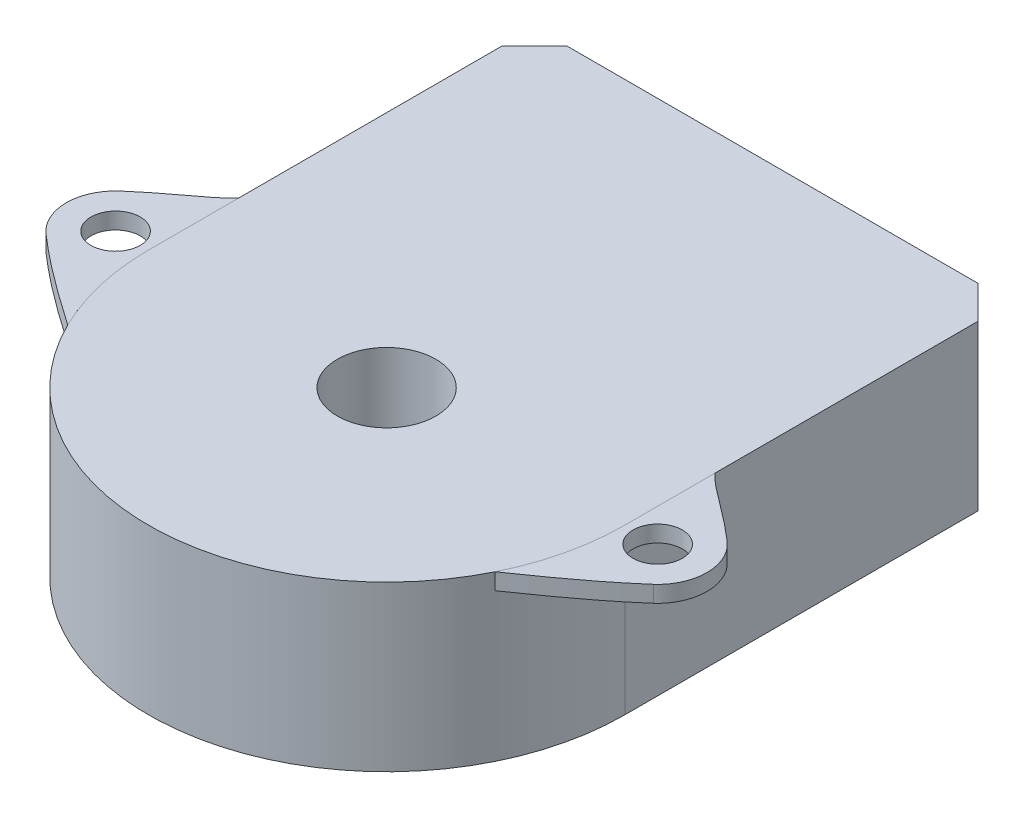
from build123d import *

# Parameters (mm, degrees)
CROQUIS1_R                = 3
SALIENTE_EXTRUIR1_DEPTH   = 10
CROQUIS2_R                = 1.5
SALIENTE_EXTRUIR2_DEPTH   = 1
SALIENTE_EXTRUIR2_2_DEPTH = 1
CHAFL_N1_SIZE             = 2


with BuildPart() as part:
    # Croquis1 → Saliente-Extruir1 (new body)
    with BuildSketch(Plane(origin=(0, 0, 0), x_dir=(-1, 0, 0), z_dir=(0, 1, 0))):
        with BuildLine():
            Line((14.5, 0), (14.5, 23.5))
            ThreePointArc((14.5, 23.5), (0, 38), (-14.5, 23.5))
            Line((-14.5, 23.5), (-14.5, 0))
            Line((-14.5, 0), (14.5, 0))
        make_face()
        with Locations(Location((0, 23.5, 0), (0, 0, 90))):
            Circle(CROQUIS1_R, mode=Mode.SUBTRACT)
    extrude(amount=SALIENTE_EXTRUIR1_DEPTH)

    # Chaflán1
    chafl_n1_edges = [part.edges().sort_by_distance(p)[0] for p in [
        (-14.5, 5, 0),
        (14.5, 5, 0),
    ]]
    chamfer(chafl_n1_edges, length=CHAFL_N1_SIZE)


with BuildPart() as body_2:
    # Croquis2 → Saliente-Extruir2 (new body)
    with BuildSketch(Plane(origin=(0, 10, 0), x_dir=(-1, 0, 0), z_dir=(0, 1, 0))):
        with BuildLine():
            Line((-14.5, 18), (-14.5, 23.5))
            ThreePointArc((-14.5, 23.5), (-14.122863947, 26.785530998), (-13.011073939, 29.900152729))
            add(Edge.make_bspline(
                [(-13.011073939, 29.900152729), (-14.952678114, 28.568382729), (-16.899307295, 27.147844067), (-18.484313483, 25.75)],
                knots=[0, 0, 0, 0, 1, 1, 1, 1], degree=3))
            ThreePointArc((-18.484313483, 25.75), (-19.5, 23.5), (-18.484313483, 21.25))
            add(Edge.make_bspline(
                [(-14.5, 18), (-14.951474475, 18.627261122), (-16.864269141, 19.821255186), (-18.484313483, 21.25)],
                knots=[0.453928844, 0.453928844, 0.453928844, 0.453928844, 1, 1, 1, 1], degree=3))
        make_face()
        with Locations(Location((-16.5, 23.5, 0), (0, 0, 90))):
            Circle(CROQUIS2_R, mode=Mode.SUBTRACT)
    extrude(amount=-SALIENTE_EXTRUIR2_DEPTH)


with BuildPart() as body_3:
    # Croquis2 → Saliente-Extruir2 2 (new body)
    with BuildSketch(Plane(origin=(0, 10, 0), x_dir=(-1, 0, 0), z_dir=(0, 1, 0))):
        with BuildLine():
            add(Edge.make_bspline(
                [(13.011073939, 29.900152729), (14.952678114, 28.568382729), (16.899307295, 27.147844067), (18.484313483, 25.75)],
                knots=[0, 0, 0, 0, 1, 1, 1, 1], degree=3))
            ThreePointArc((13.011073939, 29.900152729), (14.122863947, 26.785530998), (14.5, 23.5))
            Line((14.5, 23.5), (14.5, 18))
            add(Edge.make_bspline(
                [(14.5, 18), (14.951474475, 18.627261122), (16.864269141, 19.821255186), (18.484313483, 21.25)],
                knots=[0.453928844, 0.453928844, 0.453928844, 0.453928844, 1, 1, 1, 1], degree=3))
            ThreePointArc((18.484313483, 21.25), (19.5, 23.5), (18.484313483, 25.75))
        make_face()
        with Locations(Location((16.5, 23.5, 0), (0, 0, 90))):
            Circle(CROQUIS2_R, mode=Mode.SUBTRACT)
    extrude(amount=-SALIENTE_EXTRUIR2_2_DEPTH)


solid = Compound([part.part, body_2.part, body_3.part])
